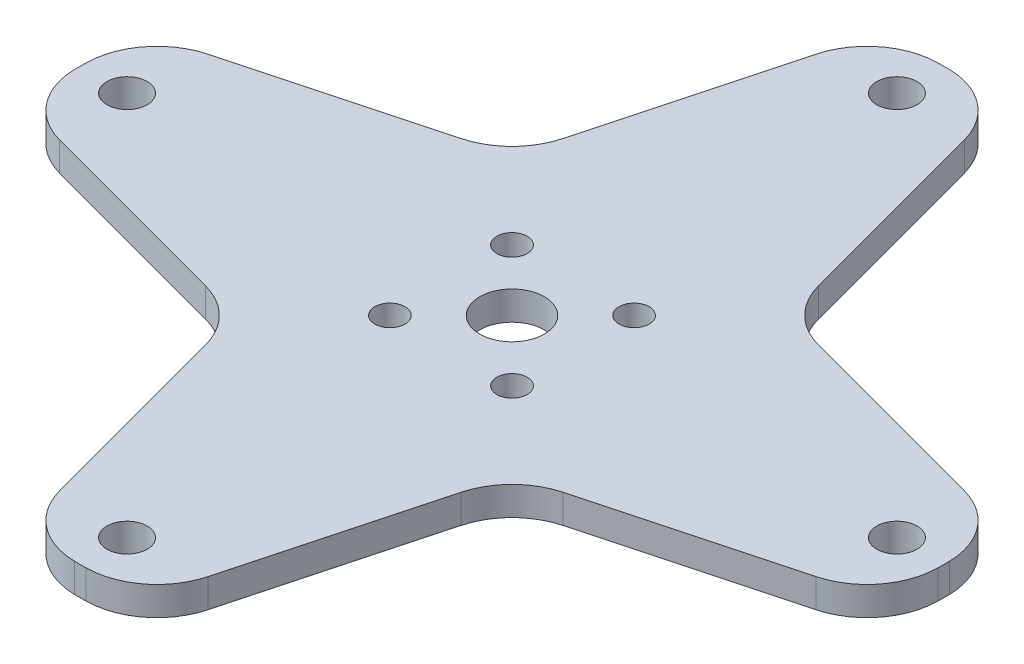
from build123d import *

# Parameters (mm, degrees)
SKETCH_1_R      = 2.8
SKETCH_1_R_2    = 2.1
SKETCH_1_R_3    = 4.5
EXTRUDE_1_DEPTH = 4
FILLET_1_R      = 10


with BuildPart() as part:
    # 草图1 → 凸台-拉伸1 (new body)
    # profile 1 of 5: a face of its own
    with BuildSketch(Plane(origin=(0, 0, 0), x_dir=(1, 0, 0), z_dir=(0, 1, 0))):
        with BuildLine():
            Line((-24.400651417, 0), (-19.24418704, 19.24418704))
            Line((-19.24418704, 19.24418704), (-59.39696962, 8.485281374))
            ThreePointArc((-59.39696962, 8.485281374), (-60, 0), (-59.39696962, -8.485281374))
            Line((-59.39696962, -8.485281374), (-19.24418704, -19.24418704))
            Line((-19.24418704, -19.24418704), (-24.400651417, 0))
        make_face()
        with Locations(Location((-53.5, 0, 0), (0, 0, 270))):
            Circle(SKETCH_1_R, mode=Mode.SUBTRACT)
    # profile 2 of 5: a face of its own
    with BuildSketch(Plane(origin=(0, 0, 0), x_dir=(1, 0, 0), z_dir=(0, 1, 0))):
        Polygon((24.400651417, 0), (19.24418704, 19.24418704), (0, 24.400651417), (-19.24418704, 19.24418704), (-24.400651417, 0), (-19.24418704, -19.24418704), (0, -24.400651417), (19.24418704, -19.24418704), align=None)
        with Locations(Location((-8.485281374, -8.485281374, 0), (0, 0, 270))):
            Circle(SKETCH_1_R_2, mode=Mode.SUBTRACT)
        with Locations(Location((0, 0, 0), (0, 0, 270))):
            Circle(SKETCH_1_R_3, mode=Mode.SUBTRACT)
        with Locations(Location((8.485281374, -8.485281374, 0), (0, 0, 270))):
            Circle(SKETCH_1_R_2, mode=Mode.SUBTRACT)
        with Locations(Location((-8.485281374, 8.485281374, 0), (0, 0, 270))):
            Circle(SKETCH_1_R_2, mode=Mode.SUBTRACT)
        with Locations(Location((8.485281374, 8.485281374, 0), (0, 0, 270))):
            Circle(SKETCH_1_R_2, mode=Mode.SUBTRACT)
    # profile 3 of 5: a face of its own
    with BuildSketch(Plane(origin=(0, 0, 0), x_dir=(1, 0, 0), z_dir=(0, 1, 0))):
        with BuildLine():
            Line((19.24418704, 19.24418704), (8.485281374, 59.39696962))
            ThreePointArc((8.485281374, 59.39696962), (0, 60), (-8.485281374, 59.39696962))
            Line((-8.485281374, 59.39696962), (-19.24418704, 19.24418704))
            Line((-19.24418704, 19.24418704), (0, 24.400651417))
            Line((0, 24.400651417), (19.24418704, 19.24418704))
        make_face()
        with Locations(Location((0, 53.5, 0), (0, 0, 270))):
            Circle(SKETCH_1_R, mode=Mode.SUBTRACT)
    # profile 4 of 5: a face of its own
    with BuildSketch(Plane(origin=(0, 0, 0), x_dir=(1, 0, 0), z_dir=(0, 1, 0))):
        with BuildLine():
            Line((59.39696962, 8.485281374), (19.24418704, 19.24418704))
            Line((19.24418704, 19.24418704), (24.400651417, 0))
            Line((24.400651417, 0), (19.24418704, -19.24418704))
            Line((19.24418704, -19.24418704), (59.39696962, -8.485281374))
            ThreePointArc((59.39696962, -8.485281374), (59.849052529, -4.253341205), (60, 0))
            ThreePointArc((60, 0), (59.849052529, 4.253341205), (59.39696962, 8.485281374))
        make_face()
        with Locations(Location((53.5, 0, 0), (0, 0, 270))):
            Circle(SKETCH_1_R, mode=Mode.SUBTRACT)
    # profile 5 of 5: a face of its own
    with BuildSketch(Plane(origin=(0, 0, 0), x_dir=(1, 0, 0), z_dir=(0, 1, 0))):
        with BuildLine():
            Line((8.485281374, -59.39696962), (19.24418704, -19.24418704))
            Line((19.24418704, -19.24418704), (0, -24.400651417))
            Line((0, -24.400651417), (-19.24418704, -19.24418704))
            Line((-19.24418704, -19.24418704), (-8.485281374, -59.39696962))
            ThreePointArc((-8.485281374, -59.39696962), (0, -60), (8.485281374, -59.39696962))
        make_face()
        with Locations(Location((0, -53.5, 0), (0, 0, 270))):
            Circle(SKETCH_1_R, mode=Mode.SUBTRACT)
    extrude(amount=EXTRUDE_1_DEPTH)

    # 圆角1
    fillet_1_edges = [part.edges().sort_by_distance(p)[0] for p in [
        (-19.24418704, 2, -19.24418704),
        (-8.485281374, 2, -59.39696962),
        (8.485281374, 2, -59.39696962),
        (19.24418704, 2, -19.24418704),
        (59.39696962, 2, -8.485281374),
        (59.39696962, 2, 8.485281374),
        (19.24418704, 2, 19.24418704),
        (8.485281374, 2, 59.39696962),
        (-8.485281374, 2, 59.39696962),
        (-19.24418704, 2, 19.24418704),
        (-59.39696962, 2, 8.485281374),
        (-59.39696962, 2, -8.485281374),
    ]]
    fillet(fillet_1_edges, radius=FILLET_1_R)


solid = part.part
